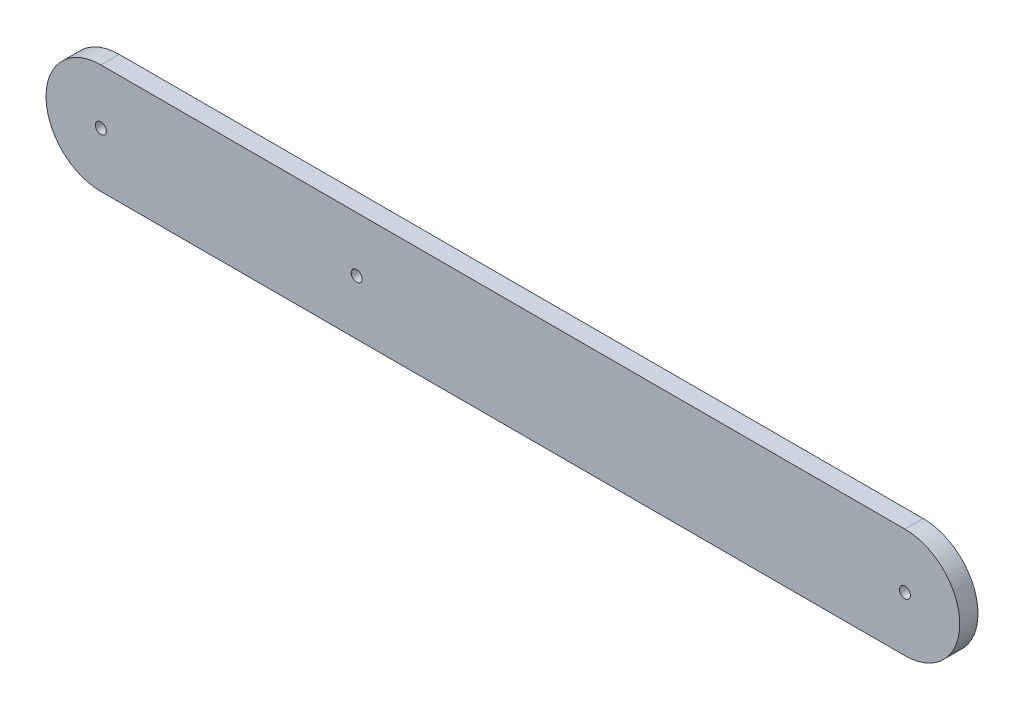
from build123d import *

# Parameters (mm, degrees)
BOSS_EXTRUDE1_DEPTH = 5
SKETCH4_R           = 1.5
CUT_EXTRUDE1_DEPTH  = 5


with BuildPart() as part:
    # Sketch3 → Boss-Extrude1 (new body)
    with BuildSketch(Plane.XY):
        with BuildLine():
            Line((-70, 15), (150, 15))
            ThreePointArc((150, 15), (165, 0), (150, -15))
            Line((150, -15), (-70, -15))
            ThreePointArc((-70, -15), (-85, 0), (-70, 15))
        make_face()
    extrude(amount=BOSS_EXTRUDE1_DEPTH)

    # Sketch4 → Cut-Extrude1 (cut)
    with BuildSketch(Plane(origin=(0, 0, 0), x_dir=(-1, 0, 0), z_dir=(0, 0, -1))):
        with Locations((-150, 0)):
            Circle(SKETCH4_R)
        Circle(SKETCH4_R)
        with Locations((70, 0)):
            Circle(SKETCH4_R)
    extrude(amount=-CUT_EXTRUDE1_DEPTH, mode=Mode.SUBTRACT)


solid = part.part
